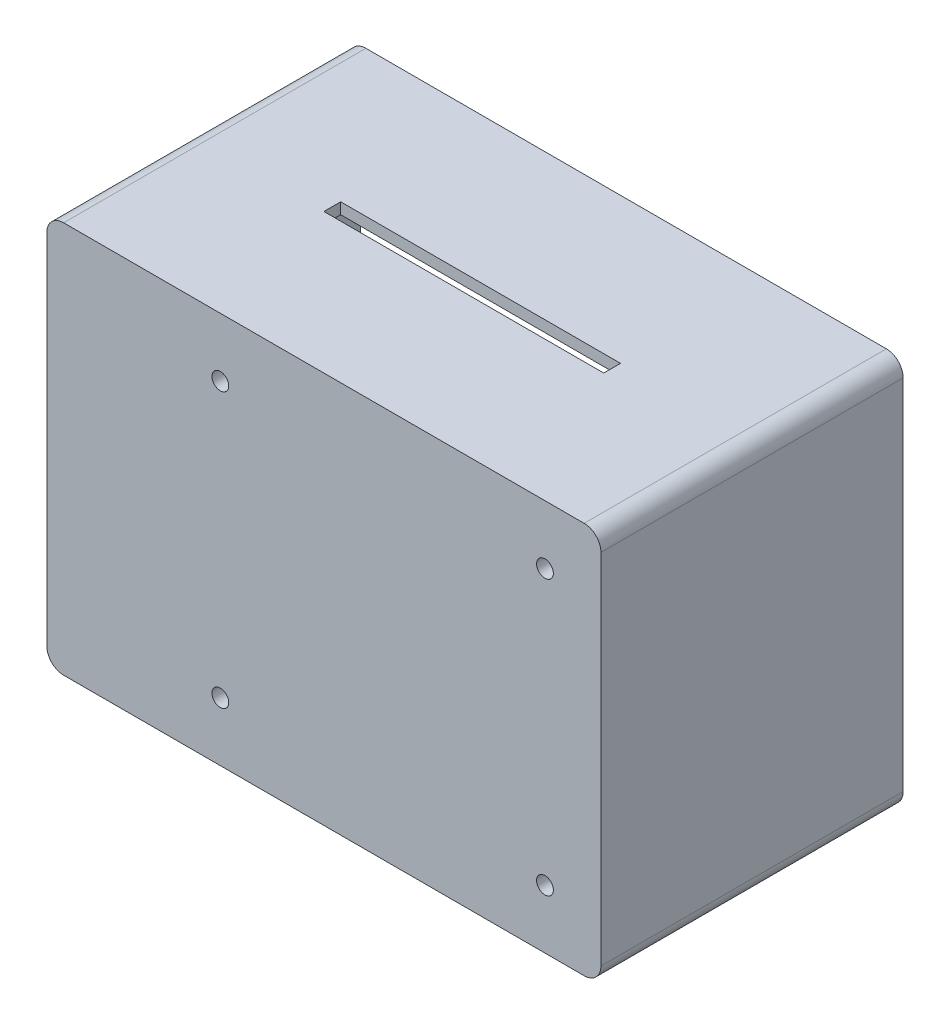
from build123d import *

# Parameters (mm, degrees)
BOSS_EXTRU_1_DEPTH      = 50
BOSS_EXTRU_2_START      = 50
BOSS_EXTRU_2_DEPTH      = 4
ESQUISSE3_R             = 1.5
ENL_V_MAT_EXTRU_1_DEPTH = 82.186513658
ESQUISSE4_W             = 14
ESQUISSE4_H             = 17
ESQUISSE4_W_2           = 16
ESQUISSE4_H_2           = 16
ESQUISSE4_W_3           = 6
ESQUISSE4_H_3           = 10
ENL_V_MAT_EXTRU_4_DEPTH = 4
ESQUISSE5_W             = 50
ESQUISSE5_H             = 3
ENL_V_MAT_EXTRU_5_DEPTH = 4


with BuildPart() as part:
    # Esquisse1 → Boss.-Extru.1 (new body)
    with BuildSketch(Plane.XY):
        with BuildLine():
            Line((-46.5, -35), (46.5, -35))
            ThreePointArc((46.5, -35), (48.621320344, -34.121320344), (49.5, -32))
            Line((49.5, -32), (49.5, 32))
            ThreePointArc((49.5, 32), (48.621320344, 34.121320344), (46.5, 35))
            Line((46.5, 35), (-46.5, 35))
            ThreePointArc((-46.5, 35), (-48.621320344, 34.121320344), (-49.5, 32))
            Line((-49.5, 32), (-49.5, -32))
            ThreePointArc((-49.5, -32), (-48.621320344, -34.121320344), (-46.5, -35))
        make_face()
        with BuildLine():
            ThreePointArc((44.5, -33), (46.621320344, -32.121320344), (47.5, -30))
            Line((47.5, -30), (47.5, 30))
            ThreePointArc((47.5, 30), (46.621320344, 32.121320344), (44.5, 33))
            Line((44.5, 33), (-44.5, 33))
            ThreePointArc((-44.5, 33), (-46.621320344, 32.121320344), (-47.5, 30))
            Line((-47.5, 30), (-47.5, -30))
            ThreePointArc((-47.5, -30), (-46.621320344, -32.121320344), (-44.5, -33))
            Line((-44.5, -33), (44.5, -33))
        make_face(mode=Mode.SUBTRACT)
    extrude(amount=BOSS_EXTRU_1_DEPTH)

    # Esquisse2 → Boss.-Extru.2 (add)
    with BuildSketch(Plane.XY.offset(BOSS_EXTRU_2_START)):
        with BuildLine():
            Line((-46.5, -35), (46.5, -35))
            ThreePointArc((46.5, -35), (48.621320344, -34.121320344), (49.5, -32))
            Line((49.5, -32), (49.5, 32))
            ThreePointArc((49.5, 32), (48.621320344, 34.121320344), (46.5, 35))
            Line((46.5, 35), (-46.5, 35))
            ThreePointArc((-46.5, 35), (-48.621320344, 34.121320344), (-49.5, 32))
            Line((-49.5, 32), (-49.5, -32))
            ThreePointArc((-49.5, -32), (-48.621320344, -34.121320344), (-46.5, -35))
        make_face()
    extrude(amount=BOSS_EXTRU_2_DEPTH)

    # Esquisse3 → Enlèv. mat.-Extru.1 (cut, through all)
    with BuildSketch(Plane.XY.offset(54)):
        with Locations((39.5, 24.5)):
            Circle(ESQUISSE3_R)
        with Locations((-18.5, 24.5)):
            Circle(ESQUISSE3_R)
        with Locations((39.5, -24.5)):
            Circle(ESQUISSE3_R)
        with Locations((-18.5, -24.5)):
            Circle(ESQUISSE3_R)
    extrude(amount=-ENL_V_MAT_EXTRU_1_DEPTH, mode=Mode.SUBTRACT)

    # Esquisse4 → Enlèv. mat.-Extru.4 (cut)
    with BuildSketch(Plane(origin=(-49.5, 0, 0), x_dir=(0, 0, -1), z_dir=(1, 0, 0))):
        with Locations((-37.5, -18)):
            Rectangle(ESQUISSE4_W, ESQUISSE4_H)
        with Locations((-36, 1)):
            Rectangle(ESQUISSE4_W_2, ESQUISSE4_H_2)
        with Locations((-36, 19)):
            Rectangle(ESQUISSE4_W_2, ESQUISSE4_H_2)
        with Locations((-13, 0)):
            Rectangle(ESQUISSE4_W_3, ESQUISSE4_H_3)
    extrude(amount=ENL_V_MAT_EXTRU_4_DEPTH, mode=Mode.SUBTRACT)

    # Esquisse5 → Enlèv. mat.-Extru.5 (cut)
    with BuildSketch(Plane(origin=(0, 35, 0), x_dir=(1, 0, 0), z_dir=(0, 1, 0))):
        with Locations((0, -27.5)):
            Rectangle(ESQUISSE5_W, ESQUISSE5_H)
    extrude(amount=-ENL_V_MAT_EXTRU_5_DEPTH, mode=Mode.SUBTRACT)


solid = part.part
